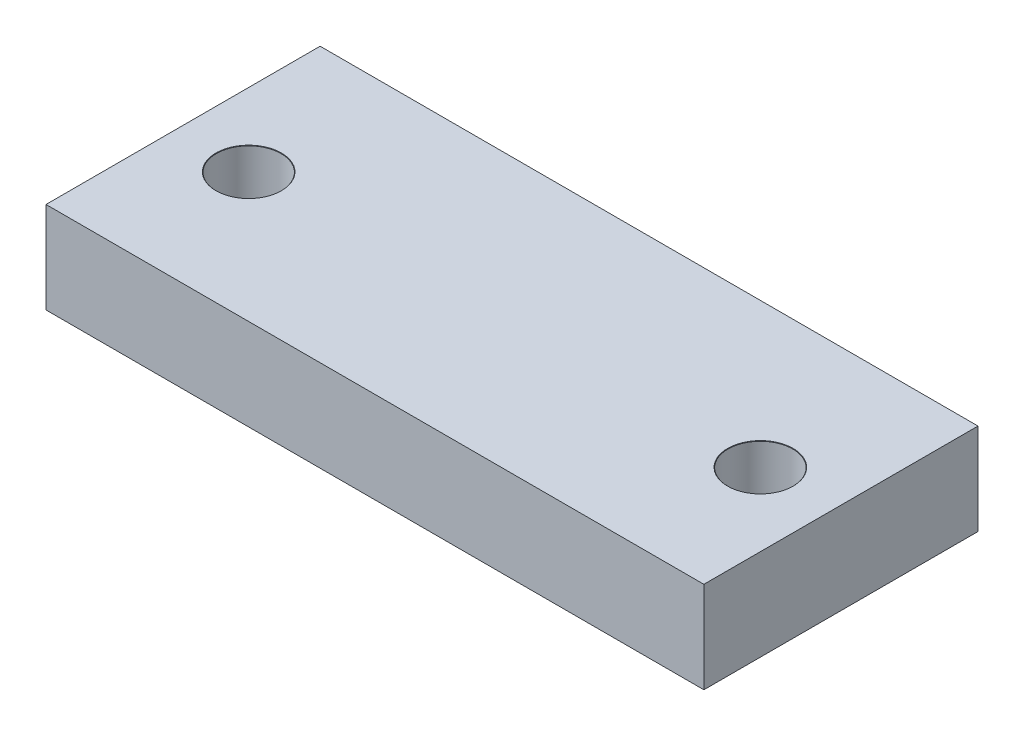
from build123d import *

# Parameters (mm, degrees)
SKETCH1_W                      = 45.72
SKETCH1_H                      = 19.05
BOSS_EXTRUDE1_DEPTH            = 3.175
M4_CLEARANCE_HOLE1_D           = 4.5
M4_CLEARANCE_HOLE1_CSINK_D     = 4.55
M4_CLEARANCE_HOLE1_CSINK_ANGLE = 90


with BuildPart() as part:
    # Sketch1 → Boss-Extrude1 (new, symmetric)
    with BuildSketch(Plane(origin=(0, 0, 0), x_dir=(1, 0, 0), z_dir=(0, 1, 0))):
        with Locations((22.86, 9.525)):
            Rectangle(SKETCH1_W, SKETCH1_H)
    extrude(amount=BOSS_EXTRUDE1_DEPTH, both=True)

    # M4 Clearance Hole1 (through all)
    with Locations(Plane(origin=(0, 3.175, 0), x_dir=(1, 0, 0), z_dir=(0, 1, 0))):
        with Locations((5.08, 9.005429498), (40.64, 9.005429498)):
            CounterSinkHole(M4_CLEARANCE_HOLE1_D / 2, M4_CLEARANCE_HOLE1_CSINK_D / 2, counter_sink_angle=M4_CLEARANCE_HOLE1_CSINK_ANGLE)


solid = part.part
